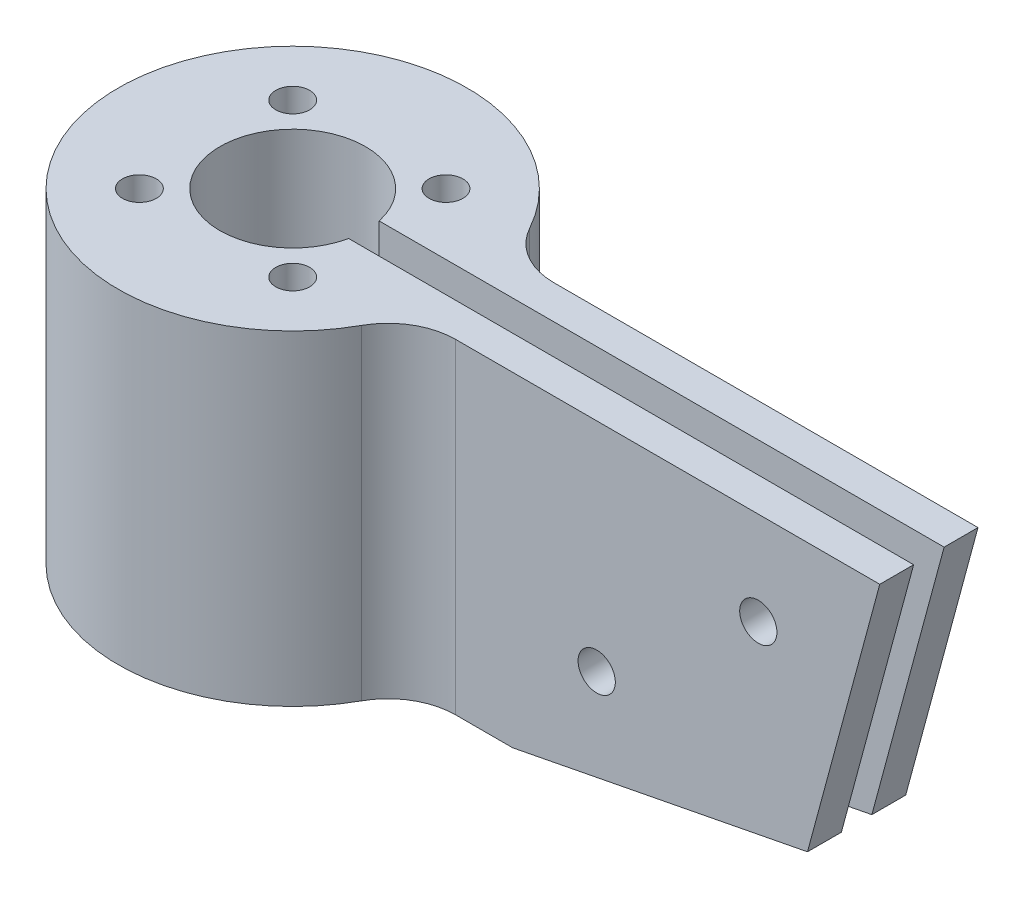
from build123d import *

# Parameters (mm, degrees)
BOSS_EXTRUDE1_DEPTH = 48
FILLET1_R           = 10
SKETCH5_R           = 2.5
CUT_EXTRUDE3_DEPTH  = 10
BOSS_EXTRUDE2_DEPTH = 5
BOSS_EXTRUDE3_DEPTH = 5
SKETCH8_R           = 2.75
CUT_EXTRUDE4_DEPTH  = 27


with BuildPart() as part:
    # Sketch1 → Boss-Extrude1 (new body)
    with BuildSketch(Plane(origin=(0, 0, 0), x_dir=(1, 0, 0), z_dir=(0, 1, 0))):
        with BuildLine():
            Line((10.511898021, 2.25), (39.708298201, 2.25))
            Line((39.708298201, 2.25), (39.708298201, 7.25))
            Line((39.708298201, 7.25), (24.708298201, 7.25))
            ThreePointArc((24.708298201, 7.25), (-25.75, 0), (24.708298201, -7.25))
            Line((24.708298201, -7.25), (39.708298201, -7.25))
            Line((39.708298201, -7.25), (39.708298201, -2.25))
            Line((39.708298201, -2.25), (10.511898021, -2.25))
            ThreePointArc((10.511898021, -2.25), (-10.75, 0), (10.511898021, 2.25))
        make_face()
    extrude(amount=BOSS_EXTRUDE1_DEPTH)

    # Fillet1
    fillet1_edges = [part.edges().sort_by_distance(p)[0] for p in [
        (24.708298201, 24, 7.25),
        (24.708298201, 24, -7.25),
    ]]
    fillet(fillet1_edges, radius=FILLET1_R)

    # Sketch5 → Cut-Extrude3 (cut)
    with BuildSketch(Plane(origin=(0, 48, 0), x_dir=(1, 0, 0), z_dir=(0, 1, 0))):
        with Locations(Location((-11.313708499, 11.313708499, 0), (0, 0, 270))):
            Circle(SKETCH5_R)
        with Locations(Location((-11.313708499, -11.313708499, 0), (0, 0, 270))):
            Circle(SKETCH5_R)
        with Locations(Location((11.313708499, -11.313708499, 0), (0, 0, 270))):
            Circle(SKETCH5_R)
        with Locations(Location((11.313708499, 11.313708499, 0), (0, 0, 270))):
            Circle(SKETCH5_R)
    extrude(amount=-CUT_EXTRUDE3_DEPTH, mode=Mode.SUBTRACT)

    # Sketch6 → Boss-Extrude2 (add)
    with BuildSketch(Plane.XY.offset(7.25)):
        Polygon((39.708298201, 0), (83.239372469, 8.461583673), (93.909140843, 48), (39.708298201, 48), align=None)
    extrude(amount=-BOSS_EXTRUDE2_DEPTH)

    # Sketch7 → Boss-Extrude3 (add)
    with BuildSketch(Plane(origin=(0, 0, -7.25), x_dir=(-1, 0, 0), z_dir=(0, 0, -1))):
        Polygon((-83.239372469, 8.461583673), (-39.708298201, 0), (-39.708298201, 48), (-93.909140843, 48), align=None)
    extrude(amount=-BOSS_EXTRUDE3_DEPTH)

    # Sketch8 → Cut-Extrude4 (cut)
    with BuildSketch(Plane(origin=(0, 0, -7.25), x_dir=(-1, 0, 0), z_dir=(0, 0, -1))):
        with Locations((-75.978050137, 34.250087132)):
            Circle(SKETCH8_R)
        with Locations((-52.123656454, 15.958069092)):
            Circle(SKETCH8_R)
    extrude(amount=-CUT_EXTRUDE4_DEPTH, mode=Mode.SUBTRACT)


solid = part.part
